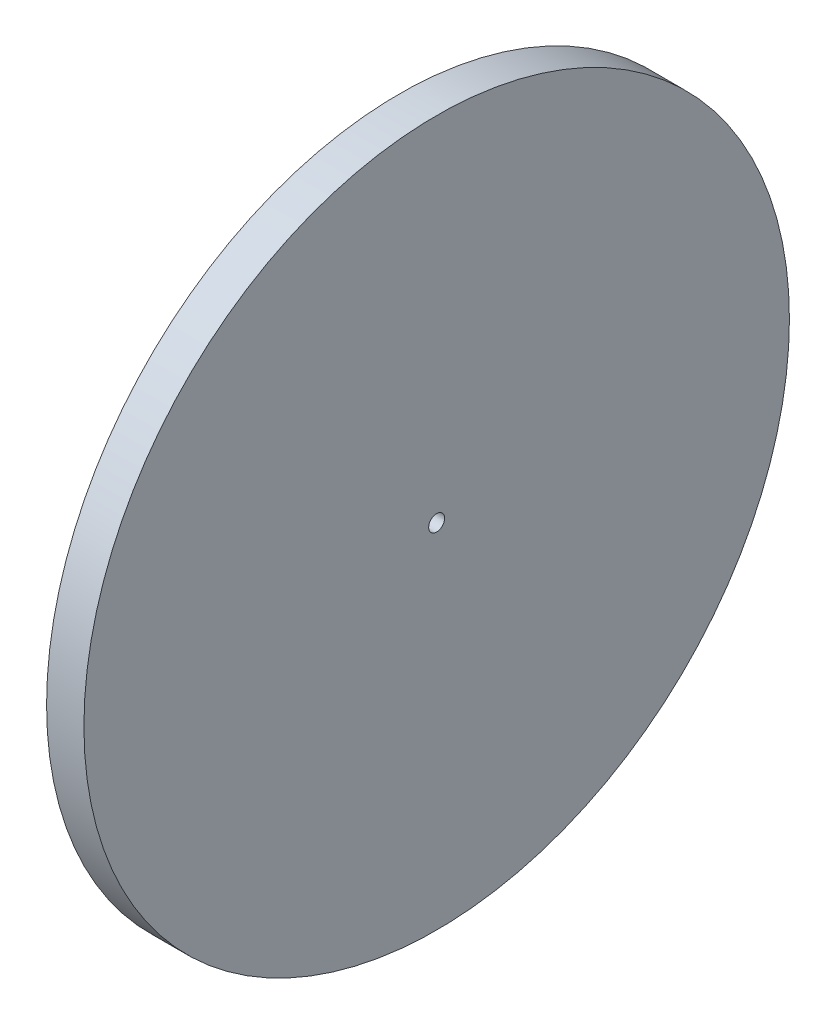
from build123d import *

# Parameters (mm, degrees)
SKETCH1_R      = 30
SKETCH1_R_2    = 0.678042933
EXTRUDE1_DEPTH = 3.175


with BuildPart() as part:
    # Sketch1 → Extrude1 (new body)
    with BuildSketch(Plane(origin=(0, 0, 0), x_dir=(0, 0, -1), z_dir=(1, 0, 0))):
        with Locations((-1.775910693, 2.66386604)):
            Circle(SKETCH1_R)
        with Locations((-1.775910693, 2.66386604)):
            Circle(SKETCH1_R_2, mode=Mode.SUBTRACT)
    extrude(amount=EXTRUDE1_DEPTH)


solid = part.part
